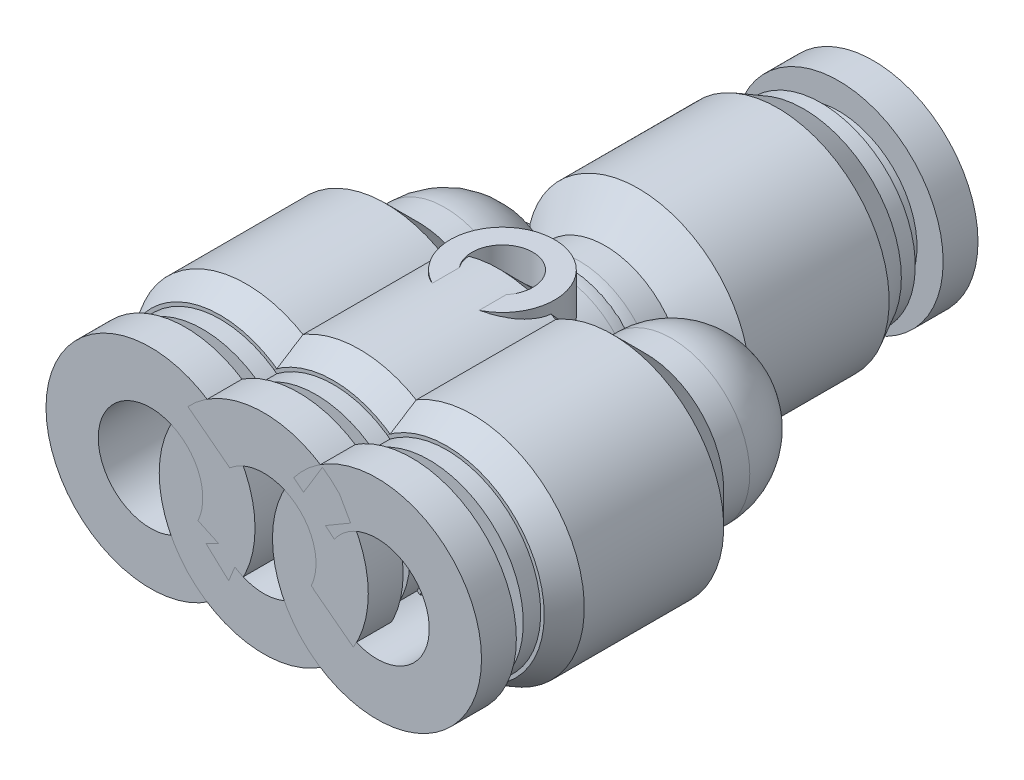
from build123d import *

# Parameters (mm, degrees)
PATTERN_LINEAR_1_COUNT   = 2
PATTERN_LINEAR_1_PITCH   = 6.5
PATTERN_LINEAR_1_2_COUNT = 2
PATTERN_LINEAR_1_2_PITCH = 6.5
EXTRUDE_1_DEPTH          = 1.5
SKETCH_3_R               = 3
SKETCH_3_R_2             = 1.75
EXTRUDE_2_DEPTH          = 6.25
SKETCH_4_R               = 1.75
CUT_EXTRUDE_1_DEPTH      = 26.153180815


with BuildPart() as part:
    # 草图1 → 旋转1 (revolve)
    with BuildSketch(Plane(origin=(0, 0, 0), x_dir=(1, 0, 0), z_dir=(0, 1, 0)), mode=Mode.PRIVATE) as revolve_1_sk:
        with BuildLine():
            Line((4.5, 0.6), (4.5, 2.1))
            Line((4.5, 2.1), (6.4, 4))
            Line((6.4, 4), (6.4, 12))
            Line((6.4, 12), (5.6, 13.5))
            Line((5.6, 13.5), (5.4, 13.5))
            Line((5.4, 13.5), (5.4, 14.5))
            Line((5.4, 14.5), (4.5, 14.5))
            Line((4.5, 14.5), (4.5, 15.5))
            Line((4.5, 15.5), (6, 15.5))
            Line((6, 15.5), (6, 17.5))
            Line((6, 17.5), (3, 17.5))
            Line((3, 17.5), (3, 7.5))
            Line((3, 7.5), (0, 7.5))
            Line((0, 7.5), (0, -3.9))
            ThreePointArc((0, -3.9), (3.181980515, -2.581980515), (4.5, 0.6))
        make_face()
    revolve(revolve_1_sk.sketch.rotate(Axis((0, 0, -8.632447835), (0, 0, 1)), 180), axis=Axis((0, 0, -8.632447835), (0, 0, 1)))


with BuildPart() as body_2:
    # 镜向1: mirrored copy
    add(part.part.mirror(Plane.XY))


with BuildPart() as pattern_linear_1_1:
    # 阵列(线性)1: pattern copy
    add(body_2.part.moved(Location(Vector(-1, 0, 0) * (1 * PATTERN_LINEAR_1_PITCH))))


with BuildPart() as pattern_linear_1_2_1:
    # Pattern Linear 1 2: pattern copy
    add(body_2.part.moved(Location(Vector(1, 0, 0) * (1 * PATTERN_LINEAR_1_2_PITCH))))


with BuildPart() as part_1:
    add(part.part)

    add(pattern_linear_1_1.part)  # 凸台-拉伸1 merges 阵列(线性)1_1

    add(pattern_linear_1_2_1.part)  # 凸台-拉伸1 merges 阵列(线性)1 2_1
    # 草图2 → 凸台-拉伸1 (add, symmetric)
    with BuildSketch(Plane(origin=(0, 0, 0), x_dir=(1, 0, 0), z_dir=(0, 1, 0))):
        Polygon((6.4, 4), (10, -1.4), (-10, -1.4), (-6.4, 4), align=None)
    extrude(amount=EXTRUDE_1_DEPTH, both=True)

    # 草图3 → 凸台-拉伸2 (add, symmetric)
    with BuildSketch(Plane(origin=(0, 0, 0), x_dir=(1, 0, 0), z_dir=(0, 1, 0))):
        with Locations(Location((0, -3.8, 0), (0, 0, 270))):
            Circle(SKETCH_3_R)
        with Locations(Location((0, -3.8, 0), (0, 0, 270))):
            Circle(SKETCH_3_R_2, mode=Mode.SUBTRACT)
    extrude(amount=EXTRUDE_2_DEPTH, both=True)

    # 草图4 → 切除-拉伸1 (cut, through all)
    with BuildSketch(Plane(origin=(0, 6.25, 0), x_dir=(1, 0, 0), z_dir=(0, 1, 0))):
        with Locations(Location((0, -3.8, 0), (0, 0, 270))):
            Circle(SKETCH_4_R)
    extrude(amount=-CUT_EXTRUDE_1_DEPTH, mode=Mode.SUBTRACT)


solid = Compound([body_2.part, part_1.part])
